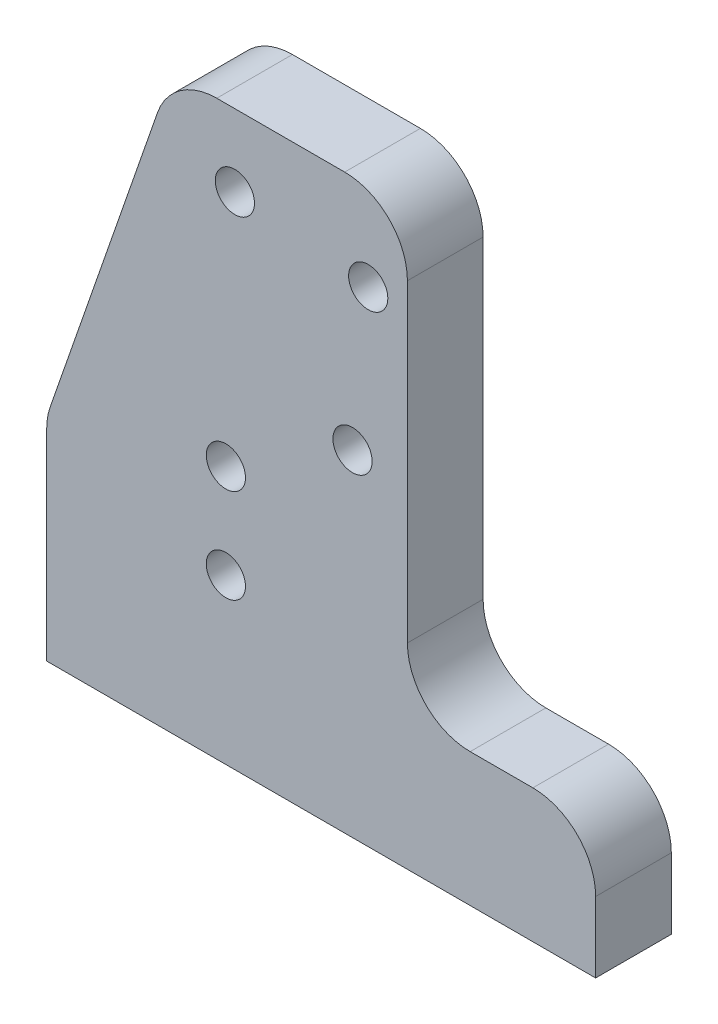
from build123d import *

# Parameters (mm, degrees)
BOSS_EXTRUDE1_DEPTH       = 4.826
M3X0_5_TAPPED_HOLE2_D     = 2.5
M3X0_5_TAPPED_HOLE3_D     = 2.5
M3X0_5_TAPPED_HOLE3_DEPTH = 5
M3X0_5_TAPPED_HOLE3_TIP   = 0.751075774
FILLET2_R                 = 4
M3X0_5_TAPPED_HOLE4_D     = 2.5
M3X0_5_TAPPED_HOLE5_D     = 2.5


with BuildPart() as part:
    # Sketch1 → Boss-Extrude1 (new body)
    with BuildSketch(Plane.XY):
        Polygon((0, 0), (0, 13.5), (8, 36.5), (23, 36.5), (23, 8.5), (35, 8.5), (35, 0), align=None)
    extrude(amount=BOSS_EXTRUDE1_DEPTH)

    # M3x0.5 Tapped Hole2 (through all)
    with Locations(Plane.XY.offset(4.826)):
        with Locations((12, 31.9)):
            Hole(M3X0_5_TAPPED_HOLE2_D / 2)

    # M3x0.5 Tapped Hole3
    with Locations(Plane(origin=(0, 0, 0), x_dir=(-1, 0, 0), z_dir=(0, -1, 0))):
        with Locations((-16.73, -2.413), (-28.73, -2.413)):
            Hole(M3X0_5_TAPPED_HOLE3_D / 2, depth=M3X0_5_TAPPED_HOLE3_DEPTH)
            with Locations((0, 0, -(M3X0_5_TAPPED_HOLE3_DEPTH + M3X0_5_TAPPED_HOLE3_TIP / 2))):  # 118° drill point
                Cone(0, M3X0_5_TAPPED_HOLE3_D / 2, M3X0_5_TAPPED_HOLE3_TIP, mode=Mode.SUBTRACT)

    # Fillet2
    fillet2_edges = [part.edges().sort_by_distance(p)[0] for p in [
        (23, 36.5, 2.413),
        (23, 8.5, 2.413),
        (35, 8.5, 2.413),
        (0, 13.5, 2.413),
        (8, 36.5, 2.413),
    ]]
    fillet(fillet2_edges, radius=FILLET2_R)

    # M3x0.5 Tapped Hole4 (through all)
    with Locations(Plane.XY.offset(4.826)):
        with Locations((19.5, 21.4), (20.5, 30.9)):
            Hole(M3X0_5_TAPPED_HOLE4_D / 2)

    # M3x0.5 Tapped Hole5 (through all)
    with Locations(Plane.XY.offset(4.826)):
        with Locations((11.425, 16.46), (11.425, 10.46)):
            Hole(M3X0_5_TAPPED_HOLE5_D / 2)


solid = part.part
